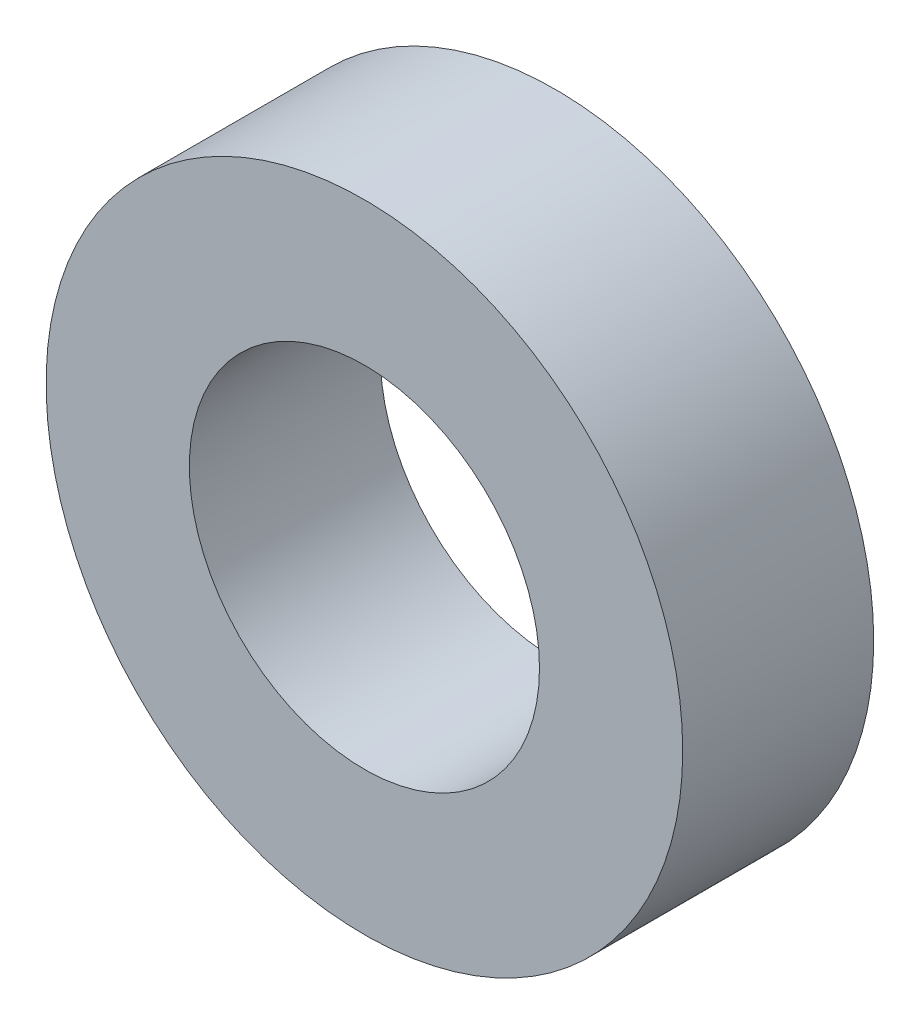
from build123d import *

# Parameters (mm, degrees)
SKETCH1_R           = 5
SKETCH1_R_2         = 2.75
BOSS_EXTRUDE1_DEPTH = 3


with BuildPart() as part:
    # Sketch1 → Boss-Extrude1 (new body)
    with BuildSketch(Plane.XY):
        Circle(SKETCH1_R)
        Circle(SKETCH1_R_2, mode=Mode.SUBTRACT)
    extrude(amount=BOSS_EXTRUDE1_DEPTH)


solid = part.part
